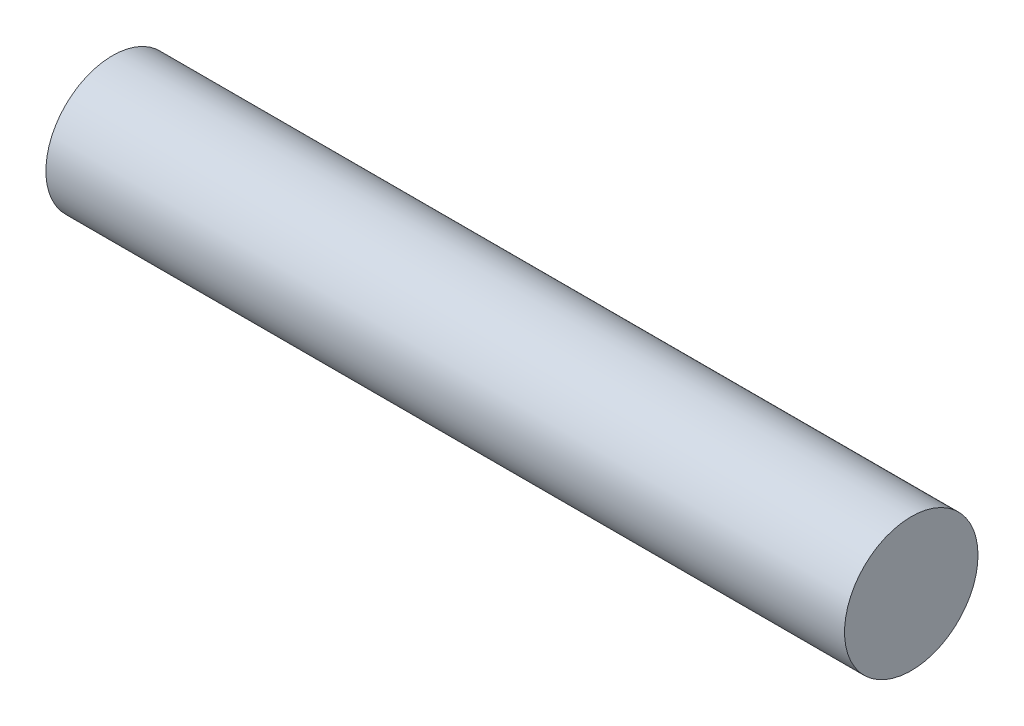
from build123d import *

# Parameters (mm, degrees)
BOSS_EXTRUDE1_DEPTH      = 103.2
BOSS_EXTRUDE1_DEPTH_BACK = 3.2
SKETCH1_R                = 8.89


with BuildPart() as part:
    # Sketch1 → Boss-Extrude1 (new, two sides: drawn at the far end of the back side and taken through both)
    with BuildSketch(Plane(origin=(0, 0, 0), x_dir=(0, 0, -1), z_dir=(1, 0, 0)).offset(-BOSS_EXTRUDE1_DEPTH_BACK)):
        Circle(SKETCH1_R)
    extrude(amount=BOSS_EXTRUDE1_DEPTH + BOSS_EXTRUDE1_DEPTH_BACK)


solid = part.part
